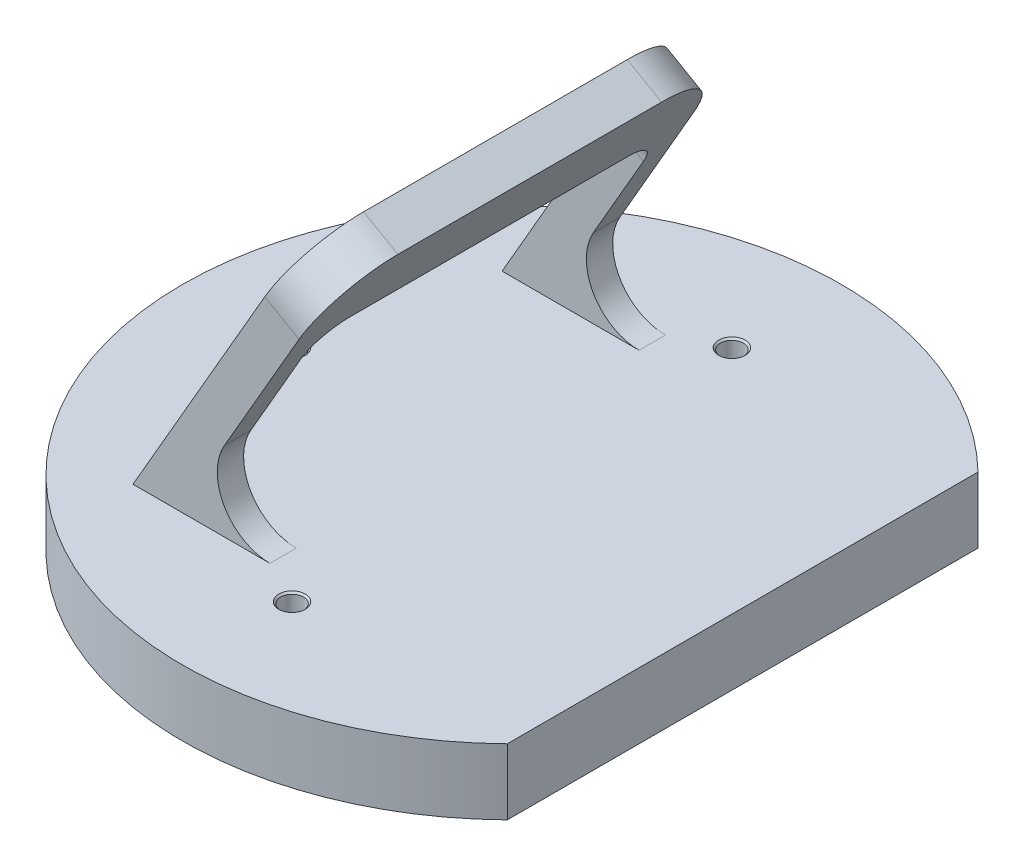
from build123d import *

# Parameters (mm, degrees)
EXTRUDE_2_DEPTH      = 20
EXTRUDE_2_2_DEPTH    = 60
CUT_EXTRUDE_2_DEPTH  = 52
FILLET_1_R           = 20
FILLET_2_R           = 10
FILLET_4_R           = 16
FILLET_5_R           = 16
M8X1_0_1_D           = 7
M8X1_0_1_CSINK_D     = 8.05
M8X1_0_1_CSINK_ANGLE = 90


with BuildPart() as part:
    # 草图1 → Extrude 2 (new body)
    with BuildSketch(Plane(origin=(0, 0, 0), x_dir=(1, 0, 0), z_dir=(0, 1, 0))):
        with BuildLine():
            Line((70, 71.414284285), (70, -71.414284285))
            ThreePointArc((70, -71.414284285), (-100, 0), (70, 71.414284285))
        make_face()
    extrude(amount=EXTRUDE_2_DEPTH)

    # 草图5 → Extrude 2 2 (add, symmetric)
    with BuildSketch(Plane.XY):
        Polygon((-55, 20), (-5, 106.602540378), (5.392304845, 100.602540378), (-44.607695155, 14), align=None)
    extrude(amount=EXTRUDE_2_2_DEPTH, both=True)

    # 草图7 → 切除-拉伸2 (cut, symmetric)
    with BuildSketch(Plane.XY):
        Polygon((-17.5, 84.951905284), (-7.107695155, 78.951905284), (-41.143593539, 20), (-55, 20), align=None)
    extrude(amount=CUT_EXTRUDE_2_DEPTH, both=True, mode=Mode.SUBTRACT)

    # 圆角1
    fillet_1_edges = [part.edges().sort_by_distance(p)[0] for p in [
        (0.196152423, 103.602540378, 60),
        (0.196152423, 103.602540378, -60),
    ]]
    fillet(fillet_1_edges, radius=FILLET_1_R)

    # 圆角2
    fillet_2_edges = [part.edges().sort_by_distance(p)[0] for p in [
        (-12.303847577, 81.951905284, -52),
        (-12.303847577, 81.951905284, 52),
    ]]
    fillet(fillet_2_edges, radius=FILLET_2_R)

    # 圆角4
    fillet_4_edges = [part.edges().sort_by_distance(p)[0] for p in [
        (-41.143593539, 20, -56),
    ]]
    fillet(fillet_4_edges, radius=FILLET_4_R)

    # 圆角5
    fillet_5_edges = [part.edges().sort_by_distance(p)[0] for p in [
        (-41.143593539, 20, 56),
    ]]
    fillet(fillet_5_edges, radius=FILLET_5_R)

    # M8x1.0 螺纹孔1 (through all)
    with Locations(Plane(origin=(0, 20, 0), x_dir=(1, 0, 0), z_dir=(0, 1, 0))):
        with Locations((-66.737936963, 0), (0, 66.737936963), (0, -66.737936963)):
            CounterSinkHole(M8X1_0_1_D / 2, M8X1_0_1_CSINK_D / 2, counter_sink_angle=M8X1_0_1_CSINK_ANGLE)


solid = part.part
